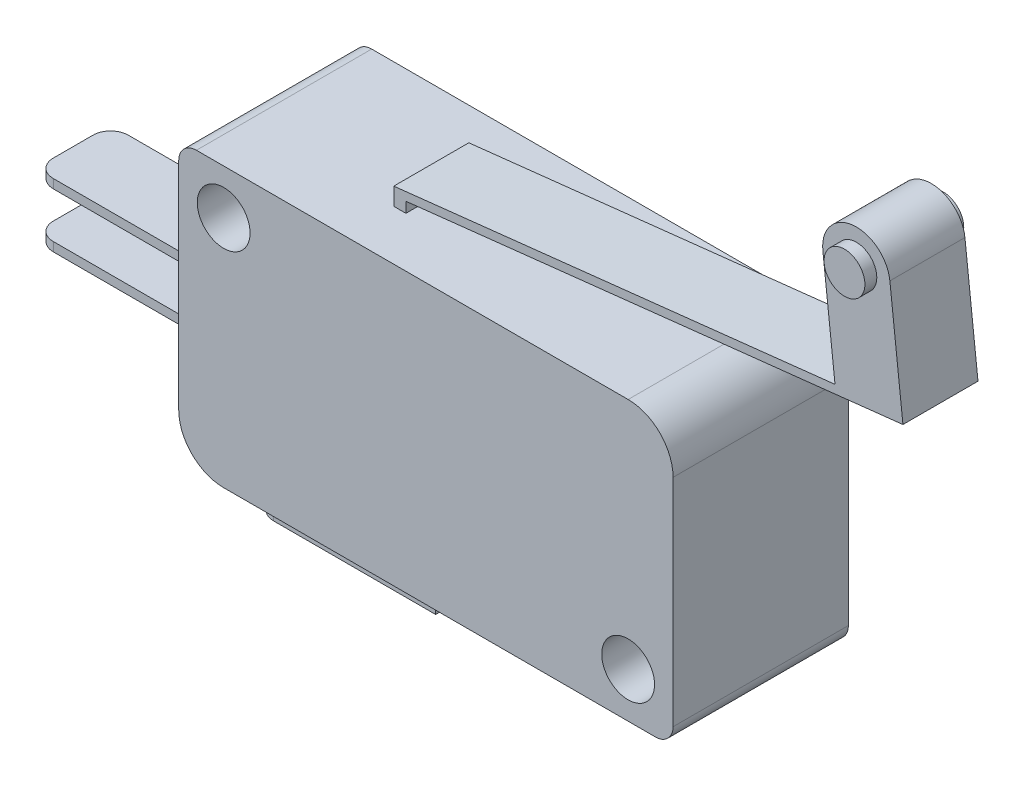
from build123d import *

# Parameters (mm, degrees)
SKETCH1_W                = 27.94
SKETCH1_H                = 15.748
BOSS_EXTRUDE1_DEPTH      = 9.906
SKETCH2_R                = 1.49225
CUT_EXTRUDE1_DEPTH       = 34.567423792
FILLET1_R                = 2.54
BOSS_EXTRUDE2_DEPTH      = 2.1209
BOSS_EXTRUDE2_DEPTH_BACK = 2.1209
SKETCH3_W                = 10.922
SKETCH3_H                = 0.508
FILLET2_R                = 1
BOSS_EXTRUDE3_DEPTH      = 2.794
BOSS_EXTRUDE3_DEPTH_BACK = 2.794
SKETCH4_R                = 1.155


with BuildPart() as part:
    # Sketch1 → Boss-Extrude1 (new body)
    with BuildSketch(Plane.XY):
        with Locations((13.97, 7.874)):
            Rectangle(SKETCH1_W, SKETCH1_H)
    extrude(amount=BOSS_EXTRUDE1_DEPTH)

    # Sketch2 → Cut-Extrude1 (cut, through all)
    with BuildSketch(Plane.XY.offset(9.906)):
        with Locations((2.54, 13.208)):
            Circle(SKETCH2_R)
        with Locations((25.4, 2.54)):
            Circle(SKETCH2_R)
    extrude(amount=-CUT_EXTRUDE1_DEPTH, mode=Mode.SUBTRACT)

    # Fillet1
    fillet1_edges = [part.edges().sort_by_distance(p)[0] for p in [
        (27.94, 15.748, 4.953),
        (0, 0, 4.953),
    ]]
    fillet(fillet1_edges, radius=FILLET1_R)

    # Sketch3 → Boss-Extrude2 (add, two sides: drawn at the far end of the back side and taken through both)
    with BuildSketch(Plane.XY.offset(4.953).offset(-BOSS_EXTRUDE2_DEPTH_BACK)):
        with BuildLine():
            Line((9.321868026, 15.748), (9.321868026, 16.736327505))
            Line((9.321868026, 16.736327505), (34.261319398, 19.503534314))
            Line((34.261319398, 19.503534314), (33.574009344, 25.69791617))
            ThreePointArc((33.574009344, 25.69791617), (35.257306032, 27.801380518), (37.360770379, 26.11808383))
            Line((37.360770379, 26.11808383), (38.1, 19.455776874))
            Line((38.1, 19.455776874), (10.0081978, 16.338794661))
            Line((10.0081978, 16.338794661), (10.0081978, 15.748))
            Line((10.0081978, 15.748), (9.321868026, 15.748))
        make_face()
        Polygon((11.178880787, 0), (11.178880787, -2.54), (1.526880787, -2.54), (1.526880787, -3.048), (11.686880787, -3.048), (11.686880787, 0), align=None)
        with Locations((-5.461, 4.149928027)):
            Rectangle(SKETCH3_W, SKETCH3_H)
        with Locations((-5.461, 7.23359273)):
            Rectangle(SKETCH3_W, SKETCH3_H)
    extrude(amount=BOSS_EXTRUDE2_DEPTH + BOSS_EXTRUDE2_DEPTH_BACK)

    # Fillet2
    fillet2_edges = [part.edges().sort_by_distance(p)[0] for p in [
        (1.526880787, -2.794, 2.8321),
        (1.526880787, -2.794, 7.0739),
        (-10.922, 4.149928027, 2.8321),
        (-10.922, 4.149928027, 7.0739),
        (0, 15.748, 4.953),
        (27.94, 0, 4.953),
        (-10.922, 7.23359273, 2.8321),
        (-10.922, 7.23359273, 7.0739),
    ]]
    fillet(fillet2_edges, radius=FILLET2_R)

    # Sketch4 → Boss-Extrude3 (add, two sides: drawn at the far end of the back side and taken through both)
    with BuildSketch(Plane.XY.offset(4.953).offset(-BOSS_EXTRUDE3_DEPTH_BACK)):
        with Locations((35.467389862, 25.908)):
            Circle(SKETCH4_R)
    extrude(amount=BOSS_EXTRUDE3_DEPTH + BOSS_EXTRUDE3_DEPTH_BACK)


solid = part.part
